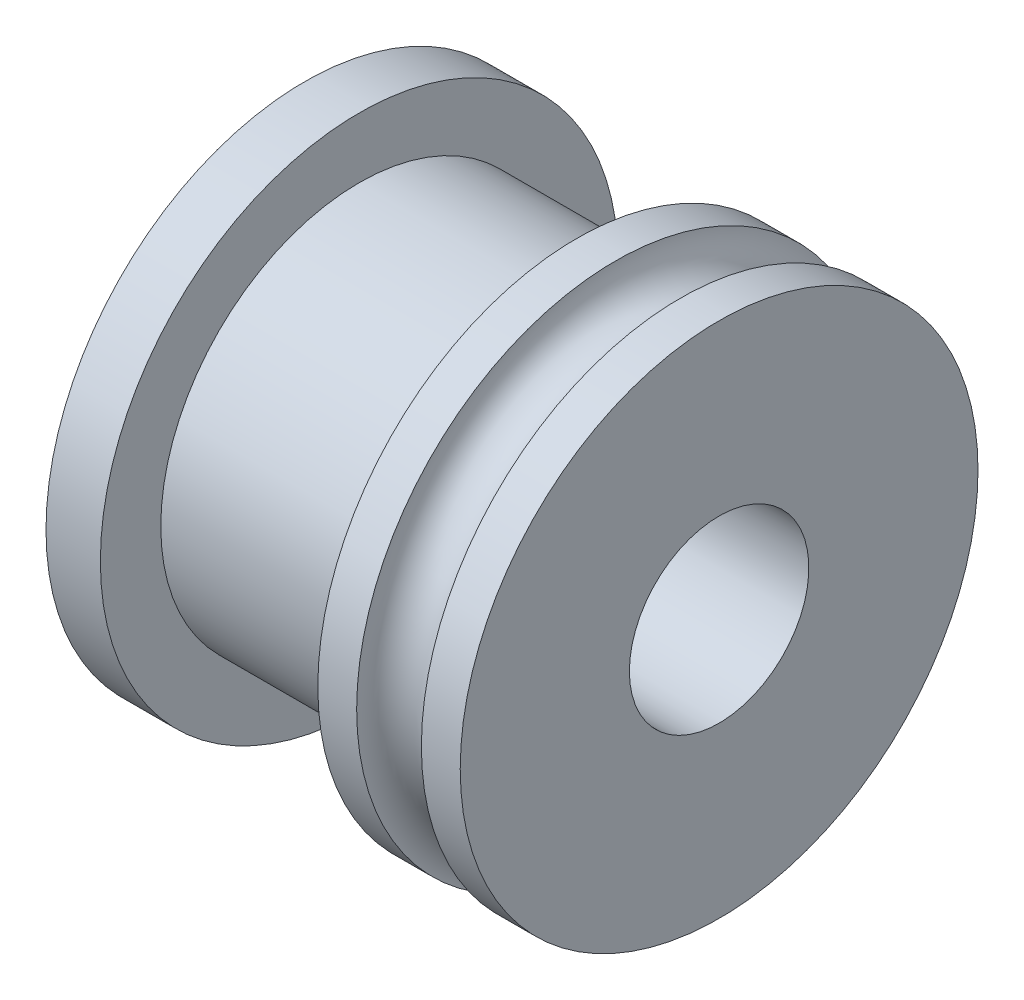
from build123d import *


with BuildPart() as part:
    # Sketch1 → Revolve1 (revolve)
    with BuildSketch(Plane.XY, mode=Mode.PRIVATE) as revolve1_sk:
        with BuildLine():
            Line((0, 3.302), (15.24, 3.302))
            Line((15.24, 3.302), (15.24, 9.525))
            Line((15.24, 9.525), (13.810625, 9.525))
            ThreePointArc((13.810625, 9.525), (12.62, 8.334375), (11.429375, 9.525))
            Line((11.429375, 9.525), (10, 9.525))
            Line((10, 9.525), (10, 7.302))
            Line((10, 7.302), (2, 7.302))
            Line((2, 7.302), (2, 9.525))
            Line((2, 9.525), (0, 9.525))
            Line((0, 9.525), (0, 3.302))
        make_face()
    revolve(revolve1_sk.sketch.rotate(Axis((0, 0, 0), (1, 0, 0)), 90), axis=Axis((0, 0, 0), (1, 0, 0)))


solid = part.part
